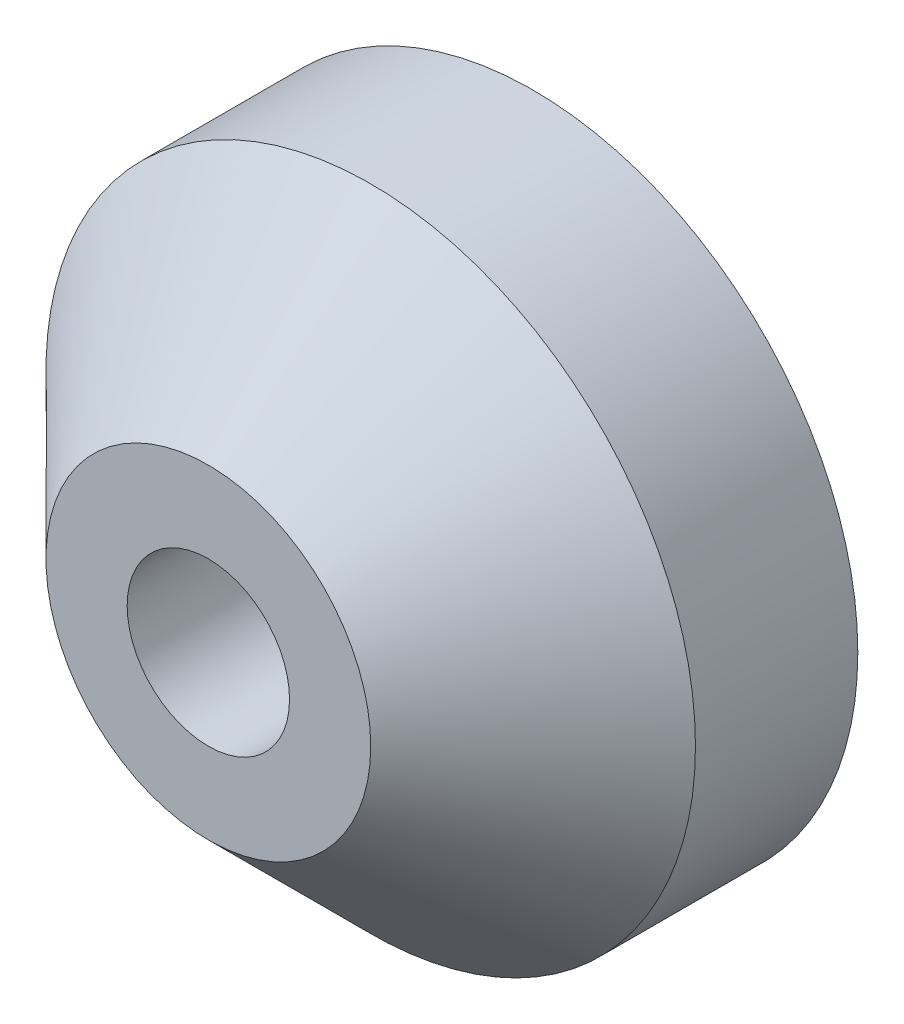
from build123d import *

# Parameters (mm, degrees)
SKETCH1_R           = 5
SKETCH1_R_2         = 1.25
BOSS_EXTRUDE1_DEPTH = 5
CHAMFER1_SIZE       = 2.5
SKETCH2_R           = 2.5
CUT_EXTRUDE1_DEPTH  = 2


with BuildPart() as part:
    # Sketch1 → Boss-Extrude1 (new body)
    with BuildSketch(Plane.XY):
        Circle(SKETCH1_R)
        Circle(SKETCH1_R_2, mode=Mode.SUBTRACT)
    extrude(amount=BOSS_EXTRUDE1_DEPTH)

    # Chamfer1
    chamfer1_edges = [part.edges().sort_by_distance(p)[0] for p in [
        (-5, 0, 5),
    ]]
    chamfer(chamfer1_edges, length=CHAMFER1_SIZE)

    # Sketch2 → Cut-Extrude1 (cut)
    with BuildSketch(Plane(origin=(0, 0, 0), x_dir=(-1, 0, 0), z_dir=(0, 0, -1))):
        Circle(SKETCH2_R)
    extrude(amount=-CUT_EXTRUDE1_DEPTH, mode=Mode.SUBTRACT)


solid = part.part
